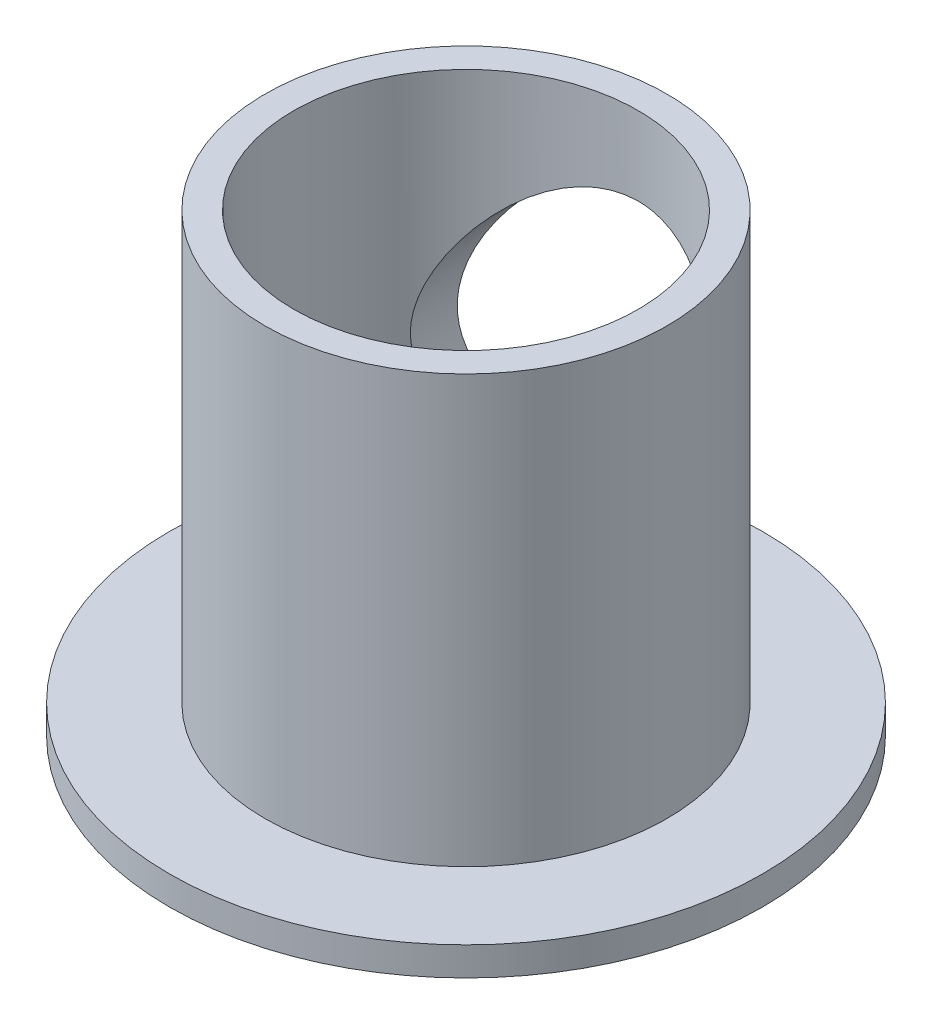
from build123d import *

# Parameters (mm, degrees)
SKETCH1_R           = 10.5
SKETCH1_R_2         = 9
BOSS_EXTRUDE1_DEPTH = 38.3
SKETCH2_R           = 15.5
SKETCH2_R_2         = 9
SKETCH2_R_3         = 1
BOSS_EXTRUDE2_DEPTH = 1.5
SKETCH10_R          = 7.65
CUT_EXTRUDE1_DEPTH  = 46.437209421
SKETCH15_R          = 20.755300819
CUT_EXTRUDE3_DEPTH  = 17.5


with BuildPart() as part:
    # Sketch1 → Boss-Extrude1 (new body)
    with BuildSketch(Plane(origin=(0, 0, 0), x_dir=(1, 0, 0), z_dir=(0, 1, 0))):
        with Locations(Location((0, 0, 0), (0, 0, 270))):
            Circle(SKETCH1_R)
        with Locations(Location((0, 0, 0), (0, 0, 270))):
            Circle(SKETCH1_R_2, mode=Mode.SUBTRACT)
    extrude(amount=BOSS_EXTRUDE1_DEPTH)

    # Sketch2 → Boss-Extrude2 (add)
    with BuildSketch(Plane(origin=(0, 38.3, 0), x_dir=(1, 0, 0), z_dir=(0, 1, 0))):
        with Locations(Location((0, 0, 0), (0, 0, 270))):
            Circle(SKETCH2_R)
        with Locations(Location((0, 0, 0), (0, 0, 270))):
            Circle(SKETCH2_R_2, mode=Mode.SUBTRACT)
        with Locations(Location((0, 12.5, 0), (0, 0, 270))):
            Circle(SKETCH2_R_3, mode=Mode.SUBTRACT)
    boss_extrude2 = extrude(amount=BOSS_EXTRUDE2_DEPTH)

    # Mirror1: Boss-Extrude2 across plane
    add(boss_extrude2.mirror(Plane(origin=(0, 19.15, 0), x_dir=(0, 0, 1), z_dir=(0, -1, 0))))

    # Sketch10 → Cut-Extrude1 (cut, through all)
    with BuildSketch(Plane.XY):
        with Locations(Location((0, 10.55, 0), (0, 0, 90))):
            Circle(SKETCH10_R)
    extrude(amount=-CUT_EXTRUDE1_DEPTH, mode=Mode.SUBTRACT)

    # Sketch15 → Cut-Extrude3 (cut)
    with BuildSketch(Plane(origin=(0, 39.8, 0), x_dir=(1, 0, 0), z_dir=(0, 1, 0))):
        Circle(SKETCH15_R)
    extrude(amount=-CUT_EXTRUDE3_DEPTH, mode=Mode.SUBTRACT)


solid = part.part
